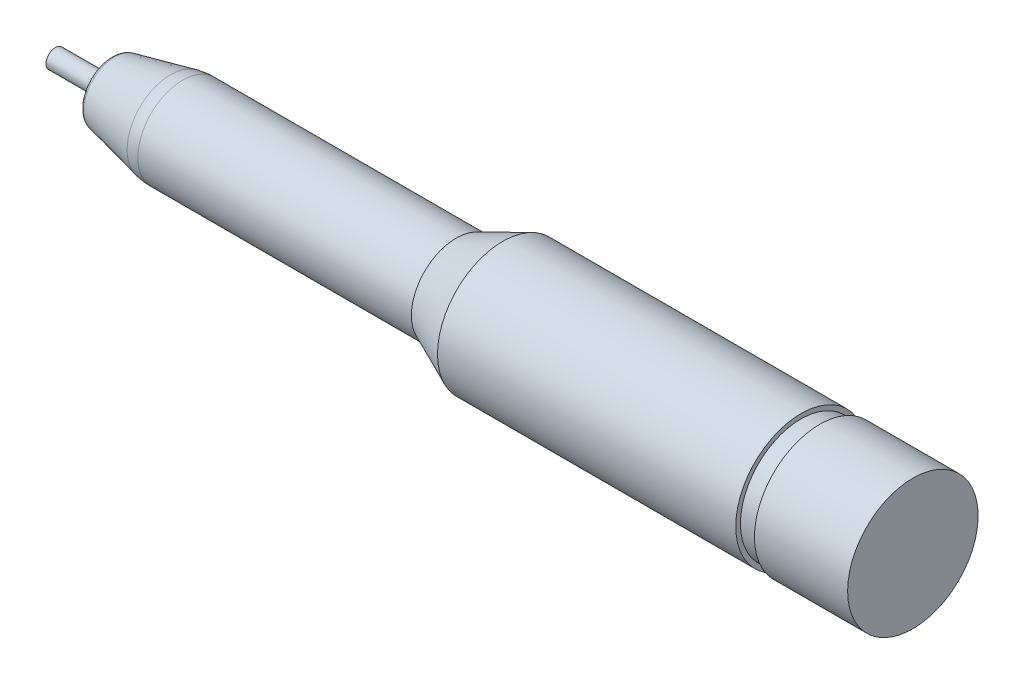
from build123d import *

# Parameters (mm, degrees)
FILETE2_R = 0.5
FILETE4_R = 6


with BuildPart() as part:
    # Esboço1 → Revolução1 (revolve)
    with BuildSketch(Plane.XY, mode=Mode.PRIVATE) as revolu_o1_sk:
        Polygon((0, 0), (92, 0), (92, 7), (82, 7), (82, 6.5), (80, 6.5), (80, 7), (48, 7), (43, 4.8), (13, 4.8), (6, 3.25), (6, 1), (0, 1), align=None)
    revolve(revolu_o1_sk.sketch.rotate(Axis((0, 0, 0), (1, 0, 0)), 90), axis=Axis((0, 0, 0), (1, 0, 0)))

    # Filete2
    filete2_edges = [part.edges().sort_by_distance(p)[0] for p in [
        (6, 0, -3.25),
    ]]
    fillet(filete2_edges, radius=FILETE2_R)

    # Filete4
    filete4_edges = [part.edges().sort_by_distance(p)[0] for p in [
        (13, 0, -4.8),
    ]]
    fillet(filete4_edges, radius=FILETE4_R)


solid = part.part
